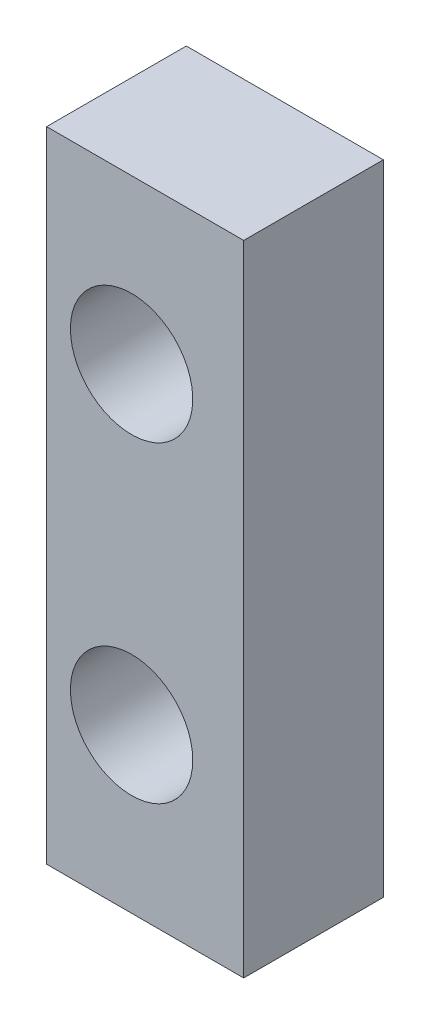
from build123d import *

# Parameters (mm, degrees)
SKETCH_2_W      = 2.822270054
SKETCH_2_H      = 9.148047763
SKETCH_2_R      = 0.875876913
EXTRUDE_1_DEPTH = 2


with BuildPart() as part:
    # 草图2 → 凸台-拉伸1 (new body)
    with BuildSketch(Plane.XY):
        with Locations((-76.257506751, -13.467115792)):
            Rectangle(SKETCH_2_W, SKETCH_2_H)
        with Locations((-76.452146065, -15.705467904)):
            Circle(SKETCH_2_R, mode=Mode.SUBTRACT)
        with Locations(Location((-76.452146065, -11.22876368, 0), (0, 0, 180))):
            Circle(SKETCH_2_R, mode=Mode.SUBTRACT)
    extrude(amount=EXTRUDE_1_DEPTH)


solid = part.part
